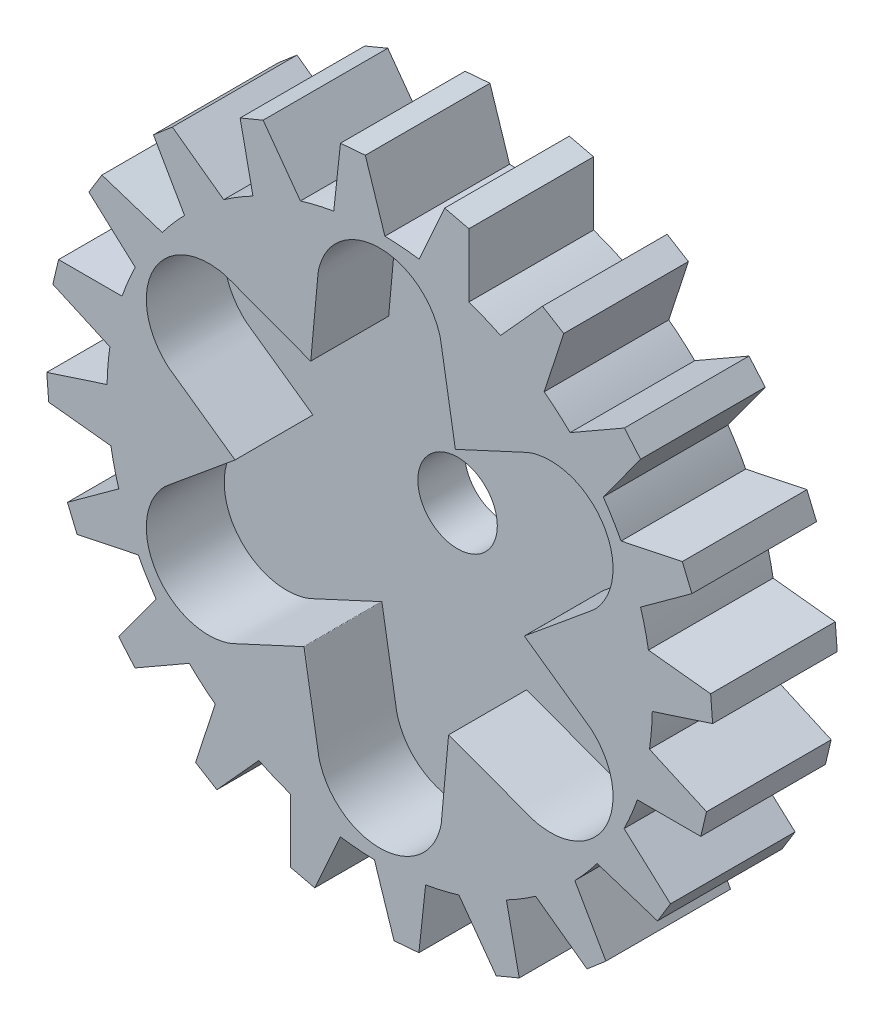
from build123d import *

# Parameters (mm, degrees)
SKETCH1_R               = 17.5
BOSS_EXTRUDE1_DEPTH     = 8
CUT_EXTRUDE1_DEPTH      = 32.261764613
CUT_EXTRUDE1_DEPTH_BACK = 32.261764613
SKETCH3_R               = 2.55
CUT_EXTRUDE2_DEPTH      = 5


with BuildPart() as part:
    # Sketch1 → Boss-Extrude1 (new body)
    with BuildSketch(Plane.XY):
        with BuildLine():
            Line((5.72690895, 20.608274926), (4.170382138, 20.978712886))
            Line((4.170382138, 20.978712886), (2.52690895, 17.31660276))
            ThreePointArc((2.52690895, 17.31660276), (4.145305381, 17.001954102), (5.72690895, 16.536399665))
            Line((5.72690895, 16.536399665), (5.72690895, 20.608274926))
        make_face()
        with BuildLine():
            Line((10.44904791, 18.66322264), (7.754357761, 15.688210086))
            ThreePointArc((7.754357761, 15.688210086), (9.19631245, 14.888849429), (10.556642598, 13.957338466))
            Line((10.556642598, 13.957338466), (11.814921252, 17.829921967))
            Line((11.814921252, 17.829921967), (10.44904791, 18.66322264))
        make_face()
        with BuildLine():
            Line((15.704888069, 14.520846128), (12.222756006, 12.524146103))
            ThreePointArc((12.222756006, 12.524146103), (13.347120382, 11.318320437), (14.353018515, 10.012035732))
            Line((14.353018515, 10.012035732), (16.746406743, 13.306252017))
            Line((16.746406743, 13.306252017), (15.704888069, 14.520846128))
        make_face()
        with BuildLine():
            Line((19.423424362, 8.957068024), (15.494705733, 8.134131438))
            ThreePointArc((15.494705733, 8.134131438), (16.191419176, 6.639875381), (16.744420977, 5.086685183))
            Line((16.744420977, 5.086685183), (20.038637262, 7.480073411))
            Line((20.038637262, 7.480073411), (19.423424362, 8.957068024))
        make_face()
        with BuildLine():
            Line((21.240660548, 2.516509694), (17.249925704, 2.947891315))
            ThreePointArc((17.249925704, 2.947891315), (17.437369352, 1.4792397), (17.5, 0))
            ThreePointArc((17.5, 0), (17.499190693, -0.16830056), (17.496762848, -0.336585553))
            Line((17.496762848, -0.336585553), (21.369346349, 0.921693101))
            Line((21.369346349, 0.921693101), (21.240660548, 2.516509694))
        make_face()
        with BuildLine():
            Line((20.978712886, -4.170382138), (17.31660276, -2.52690895))
            ThreePointArc((17.31660276, -2.52690895), (17.001954102, -4.145305381), (16.536399665, -5.72690895))
            Line((16.536399665, -5.72690895), (20.608274926, -5.72690895))
            Line((20.608274926, -5.72690895), (20.978712886, -4.170382138))
        make_face()
        with BuildLine():
            Line((18.66322264, -10.44904791), (15.688210086, -7.754357761))
            ThreePointArc((15.688210086, -7.754357761), (14.888849429, -9.19631245), (13.957338466, -10.556642598))
            Line((13.957338466, -10.556642598), (17.829921967, -11.814921252))
            Line((17.829921967, -11.814921252), (18.66322264, -10.44904791))
        make_face()
        with BuildLine():
            Line((14.520846128, -15.704888069), (12.524146103, -12.222756006))
            ThreePointArc((12.524146103, -12.222756006), (11.318320437, -13.347120382), (10.012035732, -14.353018515))
            Line((10.012035732, -14.353018515), (13.306252017, -16.746406743))
            Line((13.306252017, -16.746406743), (14.520846128, -15.704888069))
        make_face()
        with BuildLine():
            Line((8.957068024, -19.423424362), (8.134131438, -15.494705733))
            ThreePointArc((8.134131438, -15.494705733), (6.639875381, -16.191419176), (5.086685183, -16.744420977))
            Line((5.086685183, -16.744420977), (7.480073411, -20.038637262))
            Line((7.480073411, -20.038637262), (8.957068024, -19.423424362))
        make_face()
        with BuildLine():
            Line((2.516509694, -21.240660548), (2.947891315, -17.249925704))
            ThreePointArc((2.947891315, -17.249925704), (1.311473061, -17.450789048), (-0.336585553, -17.496762848))
            Line((-0.336585553, -17.496762848), (0.921693101, -21.369346349))
            Line((0.921693101, -21.369346349), (2.516509694, -21.240660548))
        make_face()
        with BuildLine():
            ThreePointArc((-2.52690895, -17.31660276), (-4.145305381, -17.001954102), (-5.72690895, -16.536399665))
            Line((-5.72690895, -16.536399665), (-5.72690895, -20.608274926))
            Line((-5.72690895, -20.608274926), (-4.170382138, -20.978712886))
            Line((-4.170382138, -20.978712886), (-2.52690895, -17.31660276))
        make_face()
        with BuildLine():
            ThreePointArc((-7.754357761, -15.688210086), (-9.19631245, -14.888849429), (-10.556642598, -13.957338466))
            Line((-10.556642598, -13.957338466), (-11.814921252, -17.829921967))
            Line((-11.814921252, -17.829921967), (-10.44904791, -18.66322264))
            Line((-10.44904791, -18.66322264), (-7.754357761, -15.688210086))
        make_face()
        with BuildLine():
            ThreePointArc((-12.222756006, -12.524146103), (-13.347120382, -11.318320437), (-14.353018515, -10.012035732))
            Line((-14.353018515, -10.012035732), (-16.746406743, -13.306252017))
            Line((-16.746406743, -13.306252017), (-15.704888069, -14.520846128))
            Line((-15.704888069, -14.520846128), (-12.222756006, -12.524146103))
        make_face()
        with BuildLine():
            ThreePointArc((-15.494705733, -8.134131438), (-16.191419176, -6.639875381), (-16.744420977, -5.086685183))
            Line((-16.744420977, -5.086685183), (-20.038637262, -7.480073411))
            Line((-20.038637262, -7.480073411), (-19.423424362, -8.957068024))
            Line((-19.423424362, -8.957068024), (-15.494705733, -8.134131438))
        make_face()
        with BuildLine():
            ThreePointArc((-17.249925704, -2.947891315), (-17.450789048, -1.311473061), (-17.496762848, 0.336585553))
            Line((-17.496762848, 0.336585553), (-21.369346349, -0.921693101))
            Line((-21.369346349, -0.921693101), (-21.240660548, -2.516509694))
            Line((-21.240660548, -2.516509694), (-17.249925704, -2.947891315))
        make_face()
        with BuildLine():
            ThreePointArc((-17.31660276, 2.52690895), (-17.001954102, 4.145305381), (-16.536399665, 5.72690895))
            Line((-16.536399665, 5.72690895), (-20.608274926, 5.72690895))
            Line((-20.608274926, 5.72690895), (-20.978712886, 4.170382138))
            Line((-20.978712886, 4.170382138), (-17.31660276, 2.52690895))
        make_face()
        with BuildLine():
            ThreePointArc((-15.688210086, 7.754357761), (-14.888849429, 9.19631245), (-13.957338466, 10.556642598))
            Line((-13.957338466, 10.556642598), (-17.829921967, 11.814921252))
            Line((-17.829921967, 11.814921252), (-18.66322264, 10.44904791))
            Line((-18.66322264, 10.44904791), (-15.688210086, 7.754357761))
        make_face()
        with BuildLine():
            ThreePointArc((-12.524146103, 12.222756006), (-11.318320437, 13.347120382), (-10.012035732, 14.353018515))
            Line((-10.012035732, 14.353018515), (-13.306252017, 16.746406743))
            Line((-13.306252017, 16.746406743), (-14.520846128, 15.704888069))
            Line((-14.520846128, 15.704888069), (-12.524146103, 12.222756006))
        make_face()
        with BuildLine():
            ThreePointArc((-8.134131438, 15.494705733), (-6.639875381, 16.191419176), (-5.086685183, 16.744420977))
            Line((-5.086685183, 16.744420977), (-7.480073411, 20.038637262))
            Line((-7.480073411, 20.038637262), (-8.957068024, 19.423424362))
            Line((-8.957068024, 19.423424362), (-8.134131438, 15.494705733))
        make_face()
        with BuildLine():
            ThreePointArc((-2.947891315, 17.249925704), (-1.311473061, 17.450789048), (0.336585553, 17.496762848))
            Line((0.336585553, 17.496762848), (-0.921693101, 21.369346349))
            Line((-0.921693101, 21.369346349), (-2.516509694, 21.240660548))
            Line((-2.516509694, 21.240660548), (-2.947891315, 17.249925704))
        make_face()
        Circle(SKETCH1_R)
    extrude(amount=BOSS_EXTRUDE1_DEPTH)

    # Sketch3 → Cut-Extrude1 (cut, two sides: drawn at the far end of the back side and taken through both)
    with BuildSketch(Plane.XY.offset(8).offset(-CUT_EXTRUDE1_DEPTH_BACK)):
        Circle(SKETCH3_R)
    extrude(amount=CUT_EXTRUDE1_DEPTH + CUT_EXTRUDE1_DEPTH_BACK, mode=Mode.SUBTRACT)

    # Sketch4 → Cut-Extrude2 (cut)
    with BuildSketch(Plane.XY.offset(8)):
        with BuildLine():
            add(Edge.make_bspline(
                [(8.421463214, -9.653914634), (7.095246797, -9.159414871), (5.76903038, -8.664915107), (4.442813963, -8.170415344), (4.44031202, -8.169482457), (4.435308133, -8.167616682), (4.422273222, -8.173641272), (4.421793577, -8.1789601), (4.421553755, -8.181619515), (4.312262947, -9.393556075), (4.20297214, -10.605492635), (4.093681332, -11.817429195), (4.08147609, -11.952774332), (4.057065605, -12.223464605), (4.020449879, -12.629500014), (3.996039394, -12.900190287), (3.983834152, -13.035535424), (3.971410991, -13.173297088), (3.946564668, -13.448820417), (3.829770692, -13.85545638), (3.734626549, -14.11561776), (3.680452914, -14.24288845), (2.155420805, -17.825662393), (-1.735279276, -17.982011173), (-3.542879046, -14.533159896), (-3.607816081, -14.409261798), (-3.72469162, -14.154652858), (-3.874917089, -13.75383399), (-3.921339059, -13.477944104), (-3.944550044, -13.33999916), (-3.967356007, -13.204461298), (-4.012967933, -12.933385573), (-4.081385823, -12.526771985), (-4.126997749, -12.25569626), (-4.149803712, -12.120158397), (-4.384662563, -10.724371408), (-4.619521414, -9.328584418), (-4.854380266, -7.932797428), (-4.854823333, -7.930164238), (-4.855709468, -7.924897858), (-4.867444372, -7.916621589), (-4.872290435, -7.918865618), (-4.874713466, -7.919987633), (-5.978926719, -8.431307297), (-7.083139972, -8.942626962), (-8.187353225, -9.453946626), (-8.310668172, -9.511049145), (-8.557298067, -9.625254181), (-8.92724291, -9.796561737), (-9.173872805, -9.910766774), (-9.297187753, -9.967869292), (-9.422704435, -10.025991351), (-9.673737799, -10.142235469), (-10.08429186, -10.2444069), (-10.357170296, -10.292090345), (-10.494476764, -10.308809946), (-14.359766069, -10.77948037), (-16.440518125, -7.488209651), (-14.35752519, -4.198356691), (-14.282694807, -4.080170521), (-14.120634767, -3.851648864), (-13.848628179, -3.521140358), (-13.632911514, -3.34299281), (-13.525053181, -3.253919036), (-13.419076931, -3.166399561), (-13.20712443, -2.991360612), (-12.889195678, -2.728802187), (-12.677243177, -2.553763238), (-12.571266926, -2.466243763), (-11.47990936, -1.564956537), (-10.388551795, -0.663669311), (-9.297194229, 0.237617915), (-9.295135353, 0.239318218), (-9.291017602, 0.242718824), (-9.289717594, 0.257019683), (-9.294084012, 0.260094482), (-9.296267221, 0.261631882), (-10.291189666, 0.962248777), (-11.286112111, 1.662865673), (-12.281034557, 2.363482569), (-12.392144262, 2.441725187), (-12.614363673, 2.598210423), (-12.947692789, 2.832938278), (-13.169912199, 2.989423514), (-13.281021905, 3.067666132), (-13.394115425, 3.147305737), (-13.620302466, 3.306584949), (-13.914062552, 3.61104948), (-14.091796845, 3.823527415), (-14.174929677, 3.934078504), (-16.515186874, 7.046182024), (-14.705238849, 10.493801522), (-10.814646144, 10.334803205), (-10.674878726, 10.329091277), (-10.395943146, 10.303003994), (-9.97371109, 10.232693631), (-9.711572455, 10.134951294), (-9.580503137, 10.086080125), (-9.451720924, 10.038061737), (-9.194156496, 9.942024961), (-8.807809855, 9.797969798), (-8.550245428, 9.701933022), (-8.421463214, 9.653914634), (-7.095246797, 9.159414871), (-5.76903038, 8.664915107), (-4.442813963, 8.170415344), (-4.44031202, 8.169482457), (-4.435308133, 8.167616682), (-4.422273222, 8.173641272), (-4.421793577, 8.1789601), (-4.421553755, 8.181619515), (-4.312262947, 9.393556075), (-4.20297214, 10.605492635), (-4.093681332, 11.817429195), (-4.08147609, 11.952774332), (-4.057065605, 12.223464605), (-4.020449879, 12.629500014), (-3.996039394, 12.900190287), (-3.983834152, 13.035535424), (-3.971410991, 13.173297088), (-3.946564668, 13.448820417), (-3.829770692, 13.85545638), (-3.734626549, 14.11561776), (-3.680452914, 14.24288845), (-2.155420805, 17.825662393), (1.735279276, 17.982011173), (3.542879046, 14.533159896), (3.607816081, 14.409261798), (3.72469162, 14.154652858), (3.874917089, 13.75383399), (3.921339059, 13.477944104), (3.944550044, 13.33999916), (3.967356007, 13.204461298), (4.012967933, 12.933385573), (4.081385823, 12.526771985), (4.126997749, 12.25569626), (4.149803712, 12.120158397), (4.384662563, 10.724371408), (4.619521414, 9.328584418), (4.854380266, 7.932797428), (4.854823333, 7.930164238), (4.855709468, 7.924897858), (4.867444372, 7.916621589), (4.872290435, 7.918865618), (4.874713466, 7.919987633), (5.978926719, 8.431307297), (7.083139972, 8.942626962), (8.187353225, 9.453946626), (8.310668172, 9.511049145), (8.557298067, 9.625254181), (8.92724291, 9.796561737), (9.173872805, 9.910766774), (9.297187753, 9.967869292), (9.422704435, 10.025991351), (9.673737799, 10.142235469), (10.08429186, 10.2444069), (10.357170296, 10.292090345), (10.494476764, 10.308809946), (14.359766069, 10.77948037), (16.440518125, 7.488209651), (14.35752519, 4.198356691), (14.282694807, 4.080170521), (14.120634767, 3.851648864), (13.848628179, 3.521140358), (13.632911514, 3.34299281), (13.525053181, 3.253919036), (13.419076931, 3.166399561), (13.20712443, 2.991360612), (12.889195678, 2.728802187), (12.677243177, 2.553763238), (12.571266926, 2.466243763), (11.47990936, 1.564956537), (10.388551795, 0.663669311), (9.297194229, -0.237617915), (9.295135353, -0.239318218), (9.291017602, -0.242718824), (9.289717594, -0.257019683), (9.294084012, -0.260094482), (9.296267221, -0.261631882), (10.291189666, -0.962248777), (11.286112111, -1.662865673), (12.281034557, -2.363482569), (12.392144262, -2.441725187), (12.614363673, -2.598210423), (12.947692789, -2.832938278), (13.169912199, -2.989423514), (13.281021905, -3.067666132), (13.394115425, -3.147305737), (13.620302466, -3.306584949), (13.914062552, -3.61104948), (14.091796845, -3.823527415), (14.174929677, -3.934078504), (16.515186874, -7.046182024), (14.705238849, -10.493801522), (10.814646144, -10.334803205), (10.674878726, -10.329091277), (10.395943146, -10.303003994), (9.97371109, -10.232693631), (9.711572455, -10.134951294), (9.580503137, -10.086080125), (9.451720924, -10.038061737), (9.194156496, -9.942024961), (8.807809855, -9.797969798), (8.550245428, -9.701933022), (8.421463214, -9.653914634)],
                knots=[0, 0, 0, 0, 0.035184891, 0.035184891, 0.035184891, 0.035251268, 0.035317645, 0.035384023, 0.035384023, 0.035384023, 0.065633172, 0.065633172, 0.065633172, 0.069011299, 0.072389426, 0.075767552, 0.075767552, 0.075767552, 0.079205994, 0.082644436, 0.086082878, 0.086082878, 0.086082878, 0.145984866, 0.145984866, 0.145984866, 0.149462172, 0.152939477, 0.156416783, 0.156416783, 0.156416783, 0.159833411, 0.163250039, 0.166666667, 0.166666667, 0.166666667, 0.201851558, 0.201851558, 0.201851558, 0.201917935, 0.201984312, 0.202050689, 0.202050689, 0.202050689, 0.232299839, 0.232299839, 0.232299839, 0.235677966, 0.239056092, 0.242434219, 0.242434219, 0.242434219, 0.245872661, 0.249311103, 0.252749544, 0.252749544, 0.252749544, 0.312651533, 0.312651533, 0.312651533, 0.316128838, 0.319606144, 0.323083449, 0.323083449, 0.323083449, 0.326500077, 0.329916705, 0.333333333, 0.333333333, 0.333333333, 0.368518224, 0.368518224, 0.368518224, 0.368584602, 0.368650979, 0.368717356, 0.368717356, 0.368717356, 0.398966506, 0.398966506, 0.398966506, 0.402344632, 0.405722759, 0.409100886, 0.409100886, 0.409100886, 0.412539328, 0.415977769, 0.419416211, 0.419416211, 0.419416211, 0.479318199, 0.479318199, 0.479318199, 0.482795505, 0.48627281, 0.489750116, 0.489750116, 0.489750116, 0.493166744, 0.496583372, 0.5, 0.5, 0.5, 0.535184891, 0.535184891, 0.535184891, 0.535251268, 0.535317645, 0.535384023, 0.535384023, 0.535384023, 0.565633172, 0.565633172, 0.565633172, 0.569011299, 0.572389426, 0.575767552, 0.575767552, 0.575767552, 0.579205994, 0.582644436, 0.586082878, 0.586082878, 0.586082878, 0.645984866, 0.645984866, 0.645984866, 0.649462172, 0.652939477, 0.656416783, 0.656416783, 0.656416783, 0.659833411, 0.663250039, 0.666666667, 0.666666667, 0.666666667, 0.701851558, 0.701851558, 0.701851558, 0.701917935, 0.701984312, 0.702050689, 0.702050689, 0.702050689, 0.732299839, 0.732299839, 0.732299839, 0.735677966, 0.739056092, 0.742434219, 0.742434219, 0.742434219, 0.745872661, 0.749311103, 0.752749544, 0.752749544, 0.752749544, 0.812651533, 0.812651533, 0.812651533, 0.816128838, 0.819606144, 0.823083449, 0.823083449, 0.823083449, 0.826500077, 0.829916705, 0.833333333, 0.833333333, 0.833333333, 0.868518224, 0.868518224, 0.868518224, 0.868584602, 0.868650979, 0.868717356, 0.868717356, 0.868717356, 0.898966506, 0.898966506, 0.898966506, 0.902344632, 0.905722759, 0.909100886, 0.909100886, 0.909100886, 0.912539328, 0.915977769, 0.919416211, 0.919416211, 0.919416211, 0.979318199, 0.979318199, 0.979318199, 0.982795505, 0.98627281, 0.989750116, 0.989750116, 0.989750116, 0.993166744, 0.996583372, 1, 1, 1, 1], degree=3, weights=[1, 1, 1, 1, 1, 1, 1, 1, 1, 1, 1, 1, 1, 1, 1, 1, 1, 1, 1, 1, 1, 1, 0.618854517, 0.618854517, 1, 1, 1, 1, 1, 1, 1, 1, 1, 1, 1, 1, 1, 1, 1, 1, 1, 1, 1, 1, 1, 1, 1, 1, 1, 1, 1, 1, 1, 1, 1, 1, 0.618854517, 0.618854517, 1, 1, 1, 1, 1, 1, 1, 1, 1, 1, 1, 1, 1, 1, 1, 1, 1, 1, 1, 1, 1, 1, 1, 1, 1, 1, 1, 1, 1, 1, 1, 1, 0.618854517, 0.618854517, 1, 1, 1, 1, 1, 1, 1, 1, 1, 1, 1, 1, 1, 1, 1, 1, 1, 1, 1, 1, 1, 1, 1, 1, 1, 1, 1, 1, 1, 1, 1, 1, 0.618854517, 0.618854517, 1, 1, 1, 1, 1, 1, 1, 1, 1, 1, 1, 1, 1, 1, 1, 1, 1, 1, 1, 1, 1, 1, 1, 1, 1, 1, 1, 1, 1, 1, 1, 1, 0.618854517, 0.618854517, 1, 1, 1, 1, 1, 1, 1, 1, 1, 1, 1, 1, 1, 1, 1, 1, 1, 1, 1, 1, 1, 1, 1, 1, 1, 1, 1, 1, 1, 1, 1, 1, 0.618854517, 0.618854517, 1, 1, 1, 1, 1, 1, 1, 1, 1, 1, 1]))
        make_face()
    extrude(amount=-CUT_EXTRUDE2_DEPTH, mode=Mode.SUBTRACT)


solid = part.part
